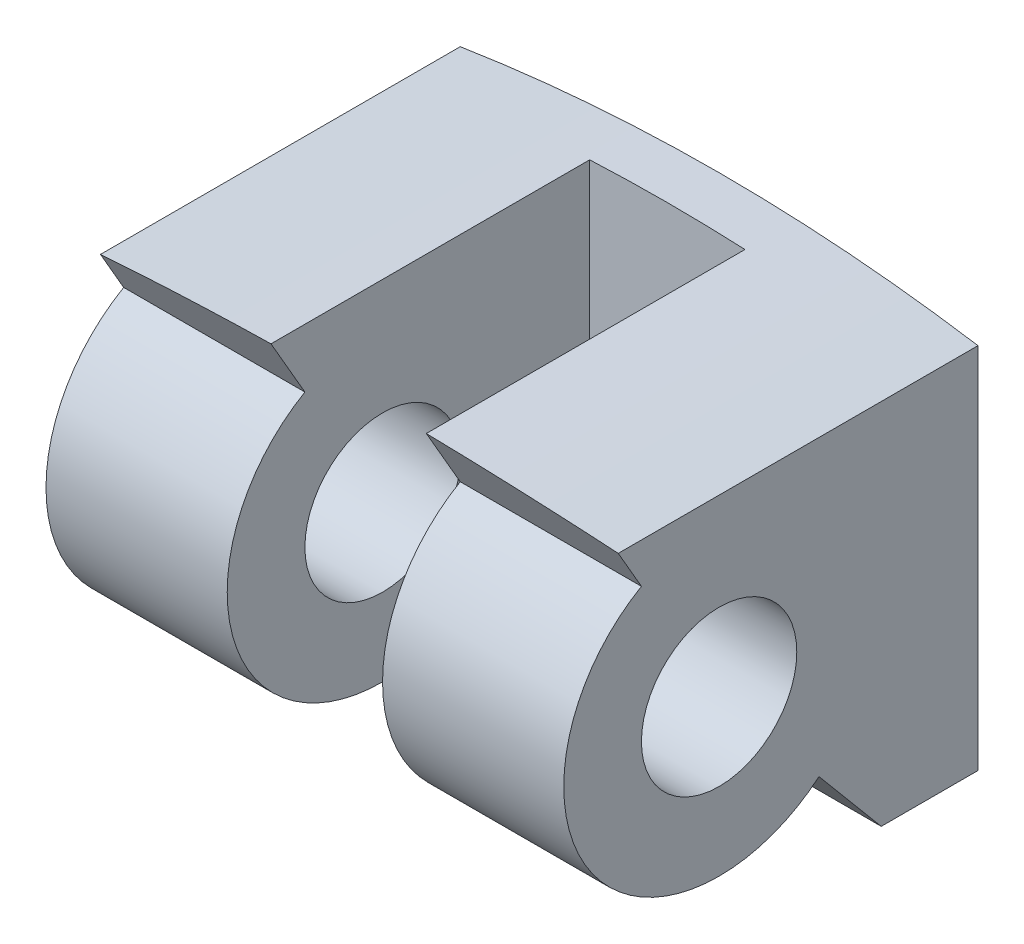
from build123d import *

# Parameters (mm, degrees)
SALIENTE_EXTRUIR1_DEPTH            = 8
CROQUIS2_W                         = 3
CROQUIS2_H                         = 7
CORTAR_EXTRUIR1_DEPTH              = 10
CORTAR_EXTRUIR3_REACH              = 35.619
CROQUIS3_R                         = 1.5
CORTAR_EXTRUIR3_DIRECTION_2_REACH  = 35.619
CROQUIS6_W                         = 10
CROQUIS6_H                         = 7
CORTAR_REVOLUCI_N4_ANGLE           = 130
CORTAR_REVOLUCI_N4_OTHER_WAY_ANGLE = 60
CROQUIS7_R                         = 0.5
CORTAR_EXTRUIR4_DEPTH              = 10


with BuildPart() as part:
    # Croquis1 → Saliente-Extruir1 (new body)
    with BuildSketch(Plane.XY):
        with BuildLine():
            Line((-5, 31.606961259), (-5, 24.5))
            Line((-5, 24.5), (5, 24.5))
            Line((5, 24.5), (5, 31.606961259))
            ThreePointArc((5, 31.606961259), (0, 32), (-5, 31.606961259))
        make_face()
    extrude(amount=SALIENTE_EXTRUIR1_DEPTH)

    # Croquis2 → Cortar-Extruir1 (cut)
    with BuildSketch(Plane.XZ.offset(-24.5)):
        with Locations((0, 4.5)):
            Rectangle(CROQUIS2_W, CROQUIS2_H)
    extrude(amount=-CORTAR_EXTRUIR1_DEPTH, mode=Mode.SUBTRACT)

    # Cortar-Extruir3: up to this face of the body (flat: up to its plane)
    cortar_extruir3_end = Plane(part.part.faces().sort_by_distance((-5, 28.053480629, 4))[0])
    # Croquis3 → Cortar-Extruir3 (cut, up to the picked face)
    with BuildSketch(Plane(origin=(-1.5, 0, 0), x_dir=(0, 0, -1), z_dir=(1, 0, 0)), mode=Mode.PRIVATE) as cortar_extruir3_sk1:
        with Locations((-5, 28.232412208)):
            Circle(CROQUIS3_R)
    cortar_extruir3_tool1 = split(extrude(cortar_extruir3_sk1.sketch, amount=-CORTAR_EXTRUIR3_REACH, mode=Mode.PRIVATE), bisect_by=cortar_extruir3_end, keep=Keep.BOTH, mode=Mode.PRIVATE)
    add(cortar_extruir3_tool1.solids().sort_by(Axis((-1.5, 28.232412, 5), (-1, 0, 0)))[0], mode=Mode.SUBTRACT)

    # Cortar-Extruir3 direction 2: up to this face of the body (flat: up to its plane)
    cortar_extruir3_direction_2_end = Plane(part.part.faces().sort_by_distance((5, 28.053480629, 4))[0])
    # Croquis3 → Cortar-Extruir3 direction 2 (cut, up to the picked face)
    with BuildSketch(Plane(origin=(-1.5, 0, 0), x_dir=(0, 0, -1), z_dir=(1, 0, 0)), mode=Mode.PRIVATE) as cortar_extruir3_direction_2_sk1:
        with Locations((-5, 28.232412208)):
            Circle(CROQUIS3_R)
    cortar_extruir3_direction_2_tool1 = split(extrude(cortar_extruir3_direction_2_sk1.sketch, amount=CORTAR_EXTRUIR3_DIRECTION_2_REACH, mode=Mode.PRIVATE), bisect_by=cortar_extruir3_direction_2_end, keep=Keep.BOTH, mode=Mode.PRIVATE)
    add(cortar_extruir3_direction_2_tool1.solids().sort_by(Axis((-1.5, 28.232412, 5), (1, 0, 0)))[0], mode=Mode.SUBTRACT)

    # Croquis6 → Cortar-Revolución4 (revolve, cut)
    with BuildSketch(Plane(origin=(0, 28.232412208, 0), x_dir=(1, 0, 0), z_dir=(0, 1, 0))):
        with Locations((0, -11.5)):
            Rectangle(CROQUIS6_W, CROQUIS6_H)
    revolve(axis=Axis((1.5, 28.232412208, 5), (1, 0, 0)), revolution_arc=CORTAR_REVOLUCI_N4_ANGLE, mode=Mode.SUBTRACT)

    # Croquis6 → Cortar-Revolución4 other way (revolve, cut)
    with BuildSketch(Plane(origin=(0, 28.232412208, 0), x_dir=(1, 0, 0), z_dir=(0, 1, 0))):
        with Locations((0, -11.5)):
            Rectangle(CROQUIS6_W, CROQUIS6_H)
    revolve(axis=Axis((1.5, 28.232412208, 5), (-1, 0, 0)), revolution_arc=CORTAR_REVOLUCI_N4_OTHER_WAY_ANGLE, mode=Mode.SUBTRACT)

    # Croquis7 → Cortar-Extruir4 (cut)
    with BuildSketch(Plane.XY.offset(1)):
        with Locations((0, 29)):
            Circle(CROQUIS7_R)
    extrude(amount=-CORTAR_EXTRUIR4_DEPTH, mode=Mode.SUBTRACT)


solid = part.part
